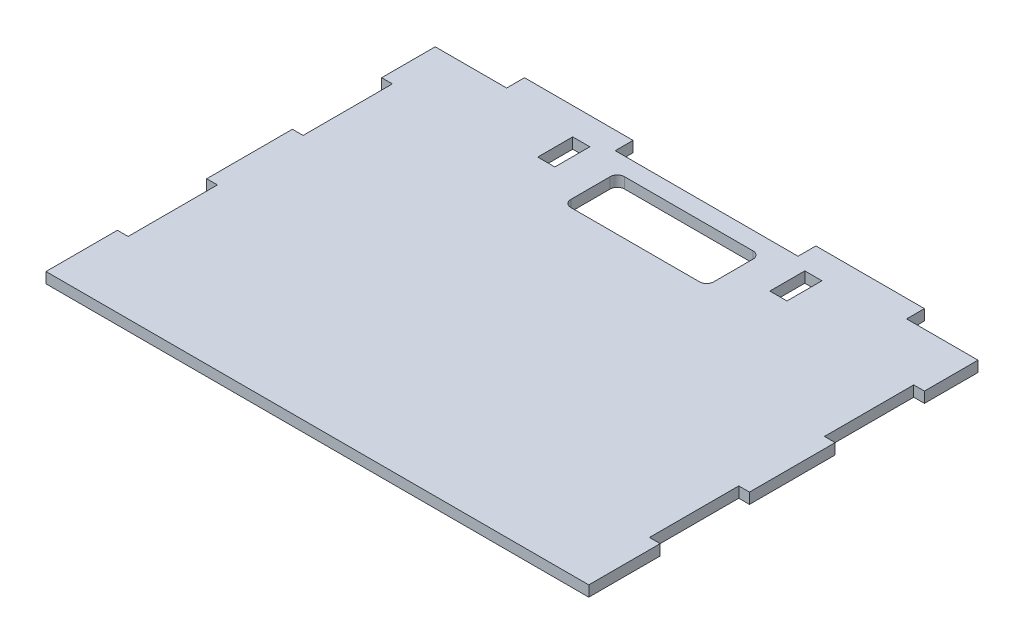
from build123d import *

# Parameters (mm, degrees)
BOSS_EXTRUDE1_DEPTH = 3
SKETCH2_W           = 4.8
SKETCH2_H           = 9.8
CUT_EXTRUDE1_DEPTH  = 96.047356618


with BuildPart() as part:
    # Sketch1 → Boss-Extrude1 (new body)
    with BuildSketch(Plane(origin=(0, 0, 0), x_dir=(1, 0, 0), z_dir=(0, 1, 0))):
        Polygon((0, 52), (0, -57), (-76, -57), (-76, -37), (-73, -37), (-73, -12), (-76, -12), (-76, 12), (-73, 12), (-73, 37), (-76, 37), (-76, 52), (-56, 52), (-56, 57), (-25.6, 57), (-25.6, 52), align=None)
    boss_extrude1 = extrude(amount=BOSS_EXTRUDE1_DEPTH)

    # Mirror1: Boss-Extrude1 across plane
    add(boss_extrude1.mirror(Plane(origin=(0, 3, -52), x_dir=(0, 0, 1), z_dir=(-1, 0, 0))))

    # Sketch2 → Cut-Extrude1 (cut, through all)
    with BuildSketch(Plane(origin=(0, 3, 0), x_dir=(1, 0, 0), z_dir=(0, 1, 0))):
        with Locations((-32.5, 44.5)):
            Rectangle(SKETCH2_W, SKETCH2_H)
        with Locations((32.5, 44.5)):
            Rectangle(SKETCH2_W, SKETCH2_H)
        with BuildLine():
            Line((-18, 47), (18, 47))
            ThreePointArc((18, 47), (19.414213562, 46.414213562), (20, 45))
            Line((20, 45), (20, 34))
            ThreePointArc((20, 34), (19.414213562, 32.585786438), (18, 32))
            Line((18, 32), (-18, 32))
            ThreePointArc((-18, 32), (-19.414213562, 32.585786438), (-20, 34))
            Line((-20, 34), (-20, 45))
            ThreePointArc((-20, 45), (-19.414213562, 46.414213562), (-18, 47))
        make_face()
    extrude(amount=-CUT_EXTRUDE1_DEPTH, mode=Mode.SUBTRACT)


solid = part.part
